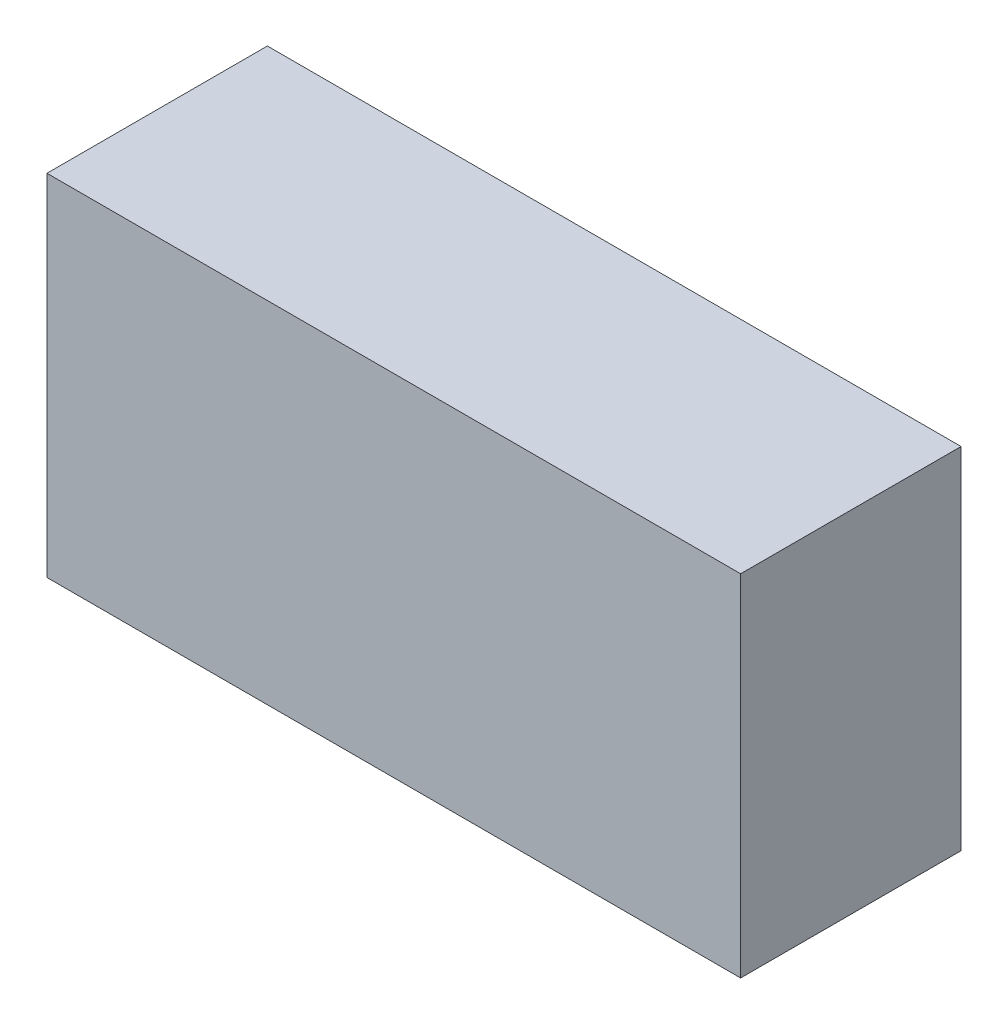
from build123d import *

# Parameters (mm, degrees)
SKETCH1_W           = 53.5
SKETCH1_H           = 17
BOSS_EXTRUDE1_DEPTH = 27


with BuildPart() as part:
    # Sketch1 → Boss-Extrude1 (new body)
    with BuildSketch(Plane(origin=(0, 0, 0), x_dir=(1, 0, 0), z_dir=(0, 1, 0))):
        Rectangle(SKETCH1_W, SKETCH1_H)
    extrude(amount=BOSS_EXTRUDE1_DEPTH)


solid = part.part
